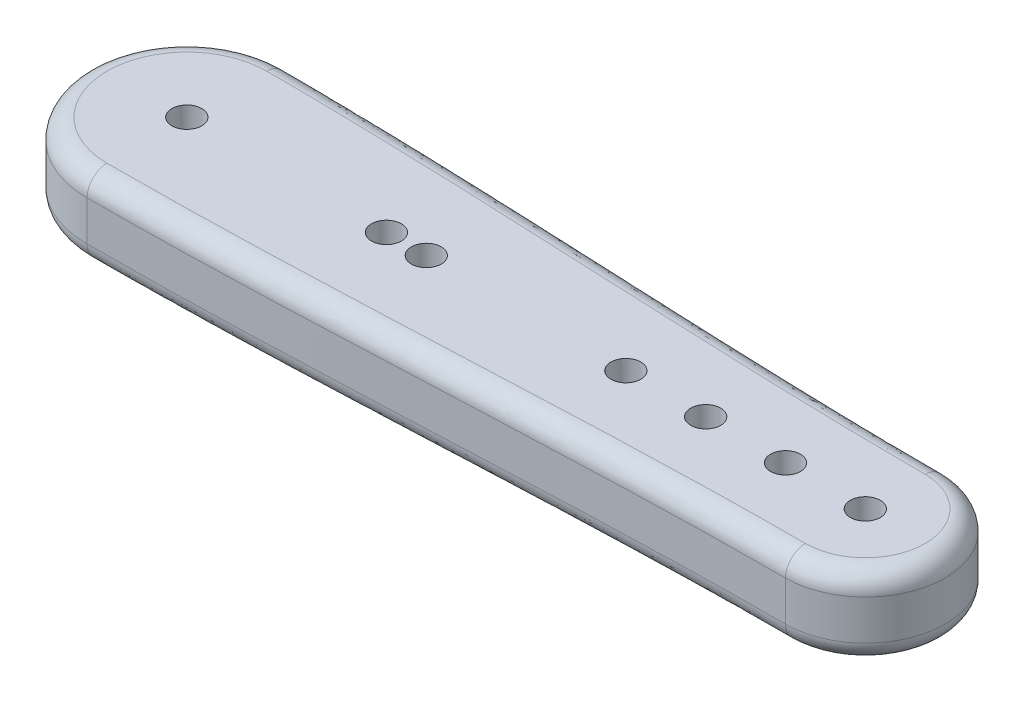
from build123d import *

# Parameters (mm, degrees)
BOSS_EXTRUDE1_DEPTH = 8
SKETCH3_R           = 1.5
CUT_EXTRUDE1_DEPTH  = 6.2
FILLET4_R           = 2
FILLET5_R           = 2


with BuildPart() as part:
    # Sketch2 → Boss-Extrude1 (new body)
    with BuildSketch(Plane(origin=(0, 0, 0), x_dir=(1, 0, 0), z_dir=(0, 1, 0))):
        with BuildLine():
            ThreePointArc((0, 10), (-10, 0), (0, -10))
            add(Edge.make_bspline(
                [(0, -10), (22.676468469, -10), (45.303936393, -8), (68, -8)],
                knots=[0, 0, 0, 0, 1, 1, 1, 1], degree=3))
            ThreePointArc((68, -8), (76, 0), (68, 8))
            add(Edge.make_bspline(
                [(0, 10), (22.676468469, 10), (45.303936393, 8), (68, 8)],
                knots=[0, 0, 0, 0, 1, 1, 1, 1], degree=3))
        make_face()
    extrude(amount=BOSS_EXTRUDE1_DEPTH)

    # Sketch3 → Cut-Extrude1 (cut)
    with BuildSketch(Plane(origin=(0, 8, 0), x_dir=(1, 0, 0), z_dir=(0, 1, 0))):
        with Locations(Location((0, 0, 0), (0, 0, 270))):
            Circle(SKETCH3_R)
        with Locations(Location((68, 0, 0), (0, 0, 270))):
            Circle(SKETCH3_R)
        with Locations(Location((20, 0, 0), (0, 0, 270))):
            Circle(SKETCH3_R)
        with Locations(Location((24, 0, 0), (0, 0, 270))):
            Circle(SKETCH3_R)
        with Locations(Location((60, 0, 0), (0, 0, 270))):
            Circle(SKETCH3_R)
        with Locations(Location((52, 0, 0), (0, 0, 270))):
            Circle(SKETCH3_R)
        with Locations(Location((44, 0, 0), (0, 0, 270))):
            Circle(SKETCH3_R)
    extrude(amount=-CUT_EXTRUDE1_DEPTH, mode=Mode.SUBTRACT)

    # Fillet4
    fillet4_edges = [part.edges().sort_by_distance(p)[0] for p in [
        (33.999990473, 8, 8.999676096),
        (76, 8, 0),
        (33.999990473, 8, -8.999676096),
        (-10, 8, 0),
    ]]
    fillet(fillet4_edges, radius=FILLET4_R)

    # Fillet5
    fillet5_edges = [part.edges().sort_by_distance(p)[0] for p in [
        (76, 0, 0),
        (33.999990473, 0, 8.999676096),
        (-10, 0, 0),
        (33.999990473, 0, -8.999676096),
    ]]
    fillet(fillet5_edges, radius=FILLET5_R)


solid = part.part
